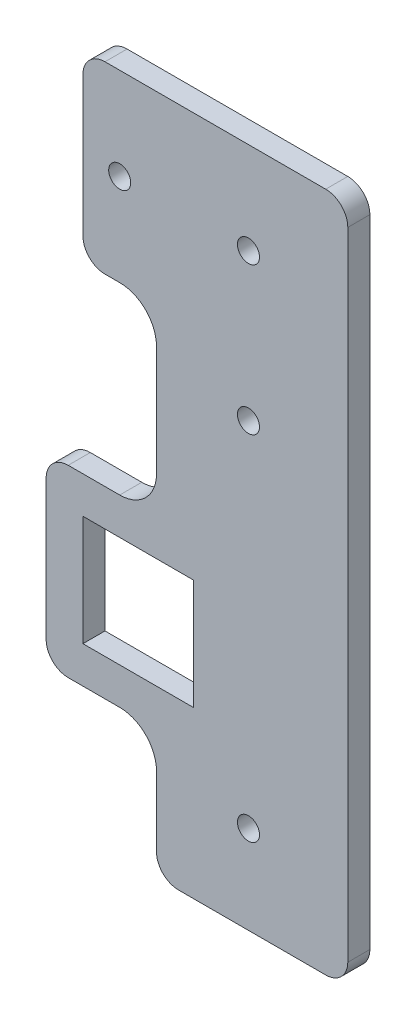
from build123d import *

# Parameters (mm, degrees)
SKETCH_1_R      = 1.5
SKETCH_1_W      = 15
SKETCH_1_H      = 15
EXTRUDE_1_DEPTH = 3
FILLET_1_R      = 5
FILLET_2_R      = 3


with BuildPart() as part:
    # 草图1 → 凸台-拉伸1 (new body)
    with BuildSketch(Plane.XY):
        Polygon((13.5, -80), (13.5, 12.5), (-22.5, 12.5), (-22.5, -12.5), (-12.5, -12.5), (-12.5, -37.5), (-27.5, -37.5), (-27.5, -62.5), (-12.5, -62.5), (-12.5, -80), align=None)
        Circle(SKETCH_1_R, mode=Mode.SUBTRACT)
        with Locations((0, -20)):
            Circle(SKETCH_1_R, mode=Mode.SUBTRACT)
        with Locations((0, -68)):
            Circle(SKETCH_1_R, mode=Mode.SUBTRACT)
        with Locations((-17.5, 0)):
            Circle(SKETCH_1_R, mode=Mode.SUBTRACT)
        with Locations((-15, -50)):
            Rectangle(SKETCH_1_W, SKETCH_1_H, mode=Mode.SUBTRACT)
    extrude(amount=EXTRUDE_1_DEPTH)

    # 圆角1
    fillet_1_edges = [part.edges().sort_by_distance(p)[0] for p in [
        (-12.5, -62.5, 1.5),
        (-12.5, -37.5, 1.5),
        (-12.5, -12.5, 1.5),
    ]]
    fillet(fillet_1_edges, radius=FILLET_1_R)

    # 圆角2
    fillet_2_edges = [part.edges().sort_by_distance(p)[0] for p in [
        (13.5, 12.5, 1.5),
        (13.5, -80, 1.5),
        (-12.5, -80, 1.5),
        (-27.5, -62.5, 1.5),
        (-27.5, -37.5, 1.5),
        (-22.5, -12.5, 1.5),
        (-22.5, 12.5, 1.5),
    ]]
    fillet(fillet_2_edges, radius=FILLET_2_R)


solid = part.part
